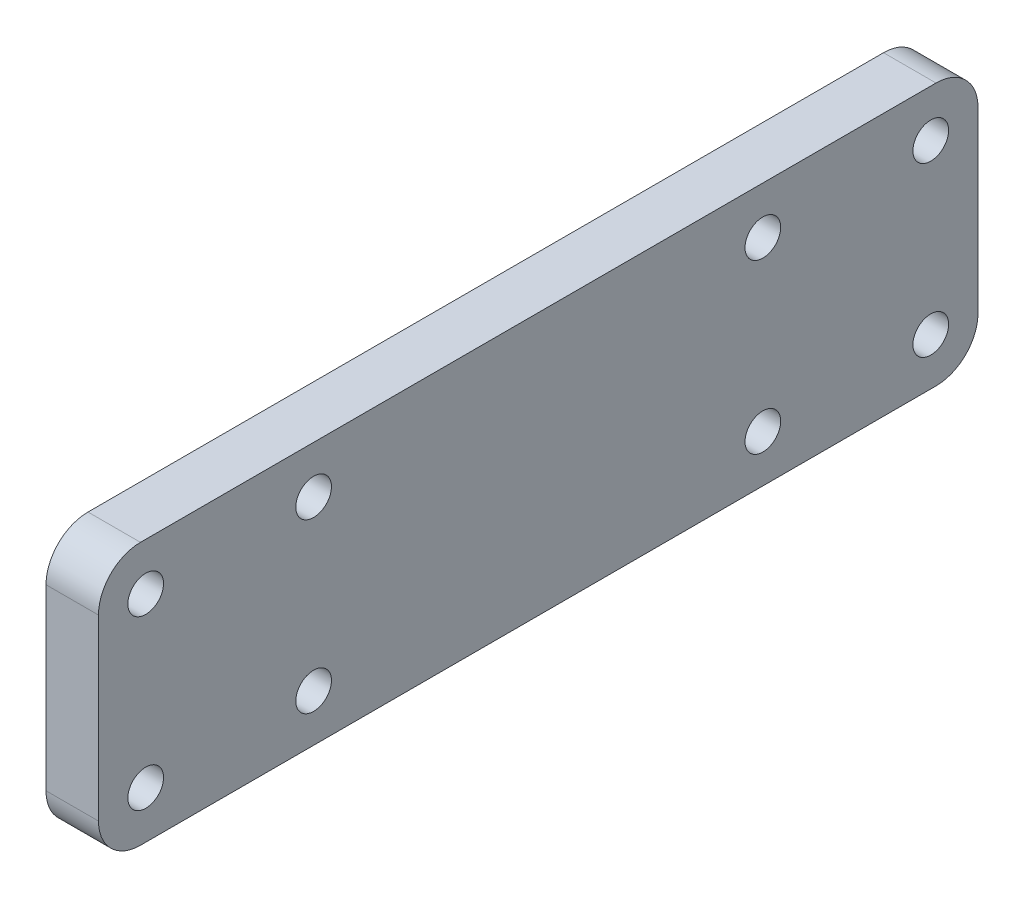
from build123d import *

# Parameters (mm, degrees)
ESQUISSE1_W        = 5
ESQUISSE1_H        = 25
BOSS_EXTRU_1_DEPTH = 83.80285333
CONG_1_R           = 4
D_GAGEMENT_M31_D   = 3.4


with BuildPart() as part:
    # Esquisse1 → Boss.-Extru.1 (new body)
    with BuildSketch(Plane.XY):
        with Locations((2.5, 0)):
            Rectangle(ESQUISSE1_W, ESQUISSE1_H)
    extrude(amount=BOSS_EXTRU_1_DEPTH)

    # Congé1
    cong_1_edges = [part.edges().sort_by_distance(p)[0] for p in [
        (2.5, -12.5, 83.80285333),
        (2.5, 12.5, 83.80285333),
        (2.5, -12.5, 0),
        (2.5, 12.5, 0),
    ]]
    fillet(cong_1_edges, radius=CONG_1_R)

    # Dégagement M31 (through all)
    with Locations(Plane(origin=(5, 0, 0), x_dir=(0, 0, -1), z_dir=(1, 0, 0))):
        with Locations((-4.5, -8), (-4.5, 8), (-20.5, 8), (-63.30285333, 8), (-79.30285333, 8), (-79.30285333, -8), (-63.30285333, -8), (-20.5, -8)):
            Hole(D_GAGEMENT_M31_D / 2)


solid = part.part
